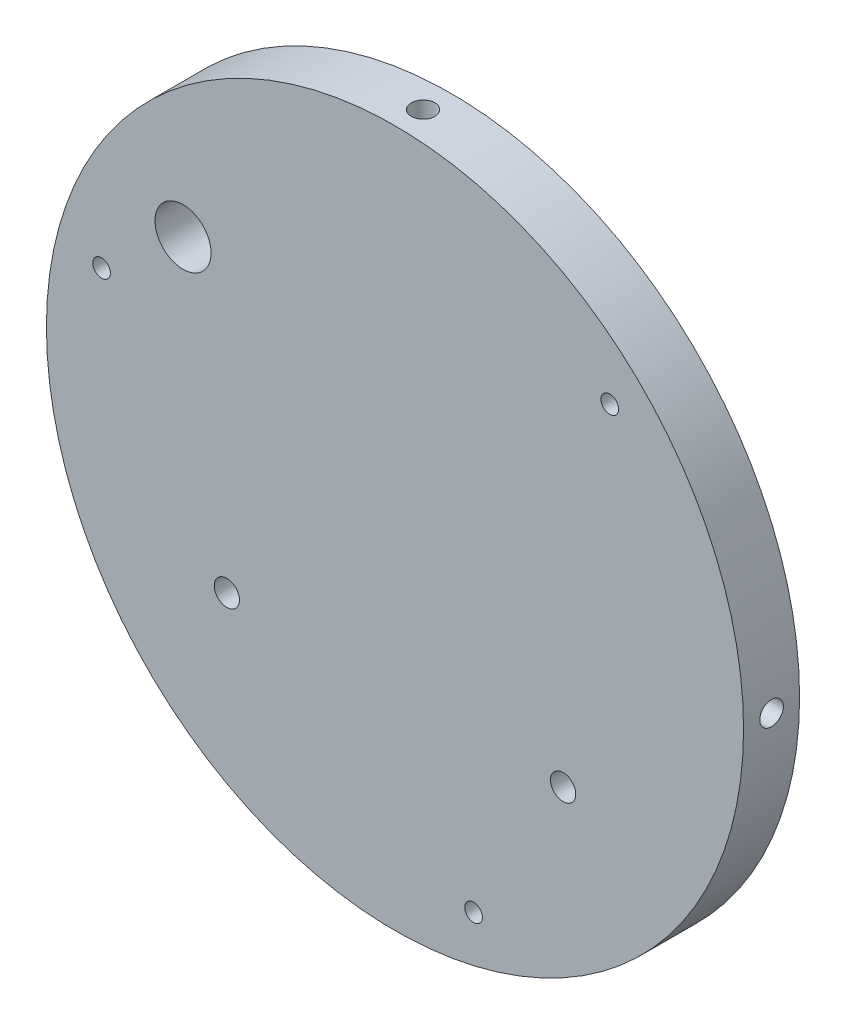
from build123d import *

# Parameters (mm, degrees)
IZIM1_R                             = 62.2
Y_KSEKLIK_EKSTR_ZYON1_DEPTH         = 10
M3X0_5_HELISARMAL_IN_DI_LI_DELIK2_D = 3.15
DAIRESEL_KAPLAMA1_COUNT             = 3
IZIM5_R                             = 5
KES_EKSTR_ZYON1_DEPTH               = 10
IZIM6_R                             = 2.25
KES_EKSTR_ZYON2_DEPTH               = 10
DAIRESEL_KAPLAMA2_COUNT             = 4


with BuildPart() as part:
    # Çizim1 → Yükseklik-Ekstrüzyon1 (new body)
    with BuildSketch(Plane.XY):
        Circle(IZIM1_R)
    extrude(amount=Y_KSEKLIK_EKSTR_ZYON1_DEPTH)

    # M3x0.5 Helisarmal İçin Dişli Delik2 (through all)
    with Locations(Plane.XY.offset(10)):
        with Locations((38.32518754, 38.32518754)):
            m3x0_5_helisarmal_in_di_li_delik2 = Hole(M3X0_5_HELISARMAL_IN_DI_LI_DELIK2_D / 2)

    # Dairesel Kaplama1: M3x0.5 Helisarmal İçin Dişli Delik2 ×3 about axis
    dairesel_kaplama1_axis = Axis((0, 0, 0), (0, 0, 1))
    for i in range(1, DAIRESEL_KAPLAMA1_COUNT):
        add(m3x0_5_helisarmal_in_di_li_delik2.rotate(dairesel_kaplama1_axis, i * 360 / DAIRESEL_KAPLAMA1_COUNT), mode=Mode.SUBTRACT)

    # Çizim5 → Kes-Ekstrüzyon1 (cut)
    with BuildSketch(Plane.XY.offset(10)):
        with Locations((-37.818561572, 26.099021067)):
            Circle(IZIM5_R)
    extrude(amount=-KES_EKSTR_ZYON1_DEPTH, mode=Mode.SUBTRACT)

    # Çizim6 → Kes-Ekstrüzyon2 (cut)
    with BuildSketch(Plane.XY.offset(10)):
        with Locations((30, -25)):
            Circle(IZIM6_R)
        with Locations((-30, -25)):
            Circle(IZIM6_R)
    extrude(amount=-KES_EKSTR_ZYON2_DEPTH, mode=Mode.SUBTRACT)

    # Çizim10 → M4x0.7 Helisarmal İçin Dişli Delik4 (revolve, cut)
    with BuildSketch(Plane(origin=(0, 62.2, 5), x_dir=(0, 0, 1), z_dir=(1, 0, 0))):
        Polygon((0, 0), (0, 13.5618073), (2.1, 12.3), (2.1, 0), align=None)
    m4x0_7_helisarmal_in_di_li_delik4 = revolve(axis=Axis((0, 68.55, 5), (0, -1, 0)), mode=Mode.SUBTRACT)

    # Dairesel Kaplama2: M4x0.7 Helisarmal İçin Dişli Delik4 ×4 about axis
    dairesel_kaplama2_axis = Axis((0, 0, 0), (0, 0, 1))
    for i in range(1, DAIRESEL_KAPLAMA2_COUNT):
        add(m4x0_7_helisarmal_in_di_li_delik4.rotate(dairesel_kaplama2_axis, i * 360 / DAIRESEL_KAPLAMA2_COUNT), mode=Mode.SUBTRACT)


solid = part.part
